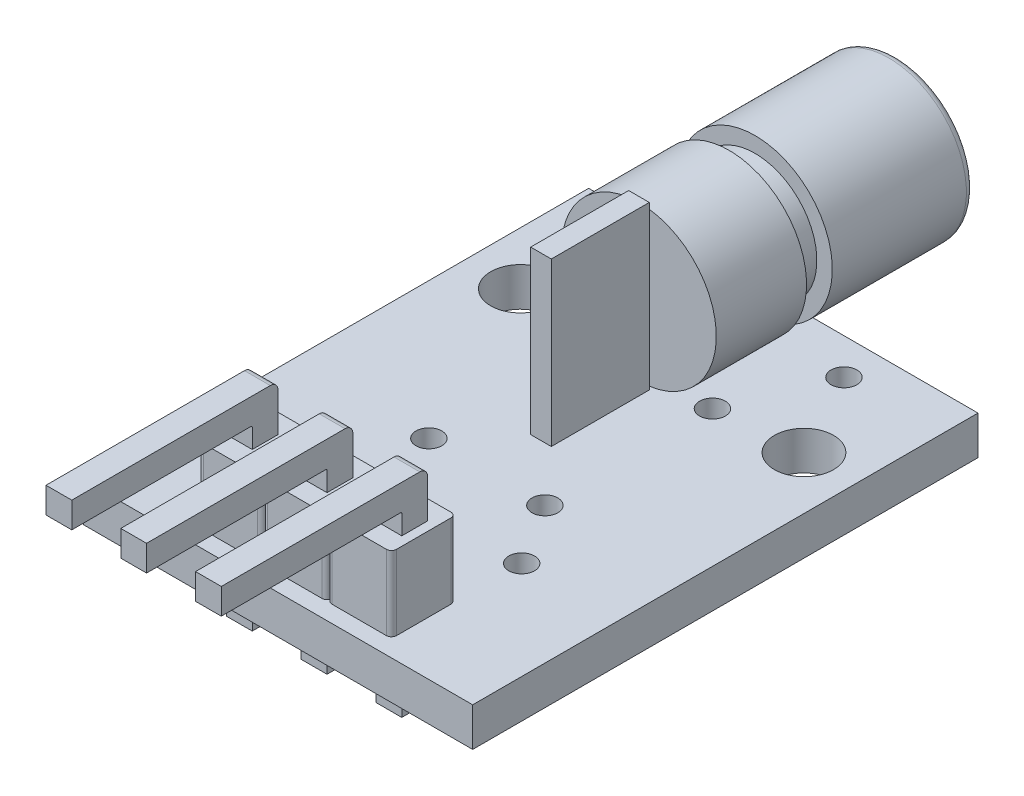
from build123d import *

# Parameters (mm, degrees)
SKETCH1_W           = 15.1
SKETCH1_H           = 19.6
BOSS_EXTRUDE1_DEPTH = 1.5
SKETCH2_W           = 1
SKETCH2_H           = 1
BOSS_EXTRUDE2_DEPTH = 1.7
BOSS_EXTRUDE3_DEPTH = 2.9
SKETCH4_W           = 1
SKETCH4_H           = 1
BOSS_EXTRUDE4_DEPTH = 1.8
SKETCH5_W           = 1
SKETCH5_H           = 1
BOSS_EXTRUDE5_DEPTH = 7
SKETCH7_W           = 0.8
SKETCH7_H           = 3.8
BOSS_EXTRUDE6_DEPTH = 6.3
SKETCH8_R           = 3
BOSS_EXTRUDE7_DEPTH = 3.5
SKETCH9_R           = 2.4
BOSS_EXTRUDE8_DEPTH = 1
SKETCH10_R          = 3
BOSS_EXTRUDE9_DEPTH = 5.5
FILLET1_R           = 0.3
SKETCH11_R          = 1.5
CUT_EXTRUDE1_DEPTH  = 1
SKETCH12_R          = 1.15
CUT_EXTRUDE2_DEPTH  = 19.271631016
CUT_EXTRUDE3_REACH  = 20.842
SKETCH13_R          = 0.5
CUT_EXTRUDE4_REACH  = 20.842
SKETCH14_R          = 0.5
FILLET2_R           = 0.2
FILLET3_R           = 0.05
FILLET5_R           = 0.3


with BuildPart() as part:
    # Sketch1 → Boss-Extrude1 (new body)
    with BuildSketch(Plane(origin=(0, 0, 0), x_dir=(1, 0, 0), z_dir=(0, 1, 0))):
        Rectangle(SKETCH1_W, SKETCH1_H)
    extrude(amount=BOSS_EXTRUDE1_DEPTH)

    # Sketch2 → Boss-Extrude2 (add)
    with BuildSketch(Plane.XZ):
        with Locations((0, 7.9)):
            Rectangle(SKETCH2_W, SKETCH2_H)
        with Locations((2.9, 7.9)):
            Rectangle(SKETCH2_W, SKETCH2_H)
        with Locations((-2.9, 7.9)):
            Rectangle(SKETCH2_W, SKETCH2_H)
    extrude(amount=BOSS_EXTRUDE2_DEPTH)

    # Sketch3 → Boss-Extrude3 (add)
    with BuildSketch(Plane(origin=(0, 1.5, 0), x_dir=(1, 0, 0), z_dir=(0, 1, 0))):
        with BuildLine():
            Line((-3.75, -9.15), (-3.75, -6.65))
            Line((-3.75, -6.65), (-1.45, -6.65))
            ThreePointArc((-1.45, -6.65), (-1.308578644, -6.708578644), (-1.25, -6.85))
            ThreePointArc((-1.25, -6.85), (-1.191421356, -6.708578644), (-1.05, -6.65))
            Line((-1.05, -6.65), (1.05, -6.65))
            ThreePointArc((1.05, -6.65), (1.191421356, -6.708578644), (1.25, -6.85))
            ThreePointArc((1.25, -6.85), (1.308578644, -6.708578644), (1.45, -6.65))
            Line((1.45, -6.65), (3.75, -6.65))
            Line((3.75, -6.65), (3.75, -9.15))
            Line((3.75, -9.15), (1.45, -9.15))
            ThreePointArc((1.45, -9.15), (1.308578644, -9.091421356), (1.25, -8.95))
            ThreePointArc((1.25, -8.95), (1.191421356, -9.091421356), (1.05, -9.15))
            Line((1.05, -9.15), (-1.05, -9.15))
            ThreePointArc((-1.05, -9.15), (-1.191421356, -9.091421356), (-1.25, -8.95))
            ThreePointArc((-1.25, -8.95), (-1.308578644, -9.091421356), (-1.45, -9.15))
            Line((-1.45, -9.15), (-3.75, -9.15))
        make_face()
    extrude(amount=BOSS_EXTRUDE3_DEPTH)

    # Sketch4 → Boss-Extrude4 (add)
    with BuildSketch(Plane(origin=(0, 4.4, 0), x_dir=(1, 0, 0), z_dir=(0, 1, 0))):
        with Locations((-2.9, -7.9)):
            Rectangle(SKETCH4_W, SKETCH4_H)
        with Locations((0, -7.9)):
            Rectangle(SKETCH4_W, SKETCH4_H)
        with Locations((2.9, -7.9)):
            Rectangle(SKETCH4_W, SKETCH4_H)
    extrude(amount=BOSS_EXTRUDE4_DEPTH)

    # Sketch5 → Boss-Extrude5 (add)
    with BuildSketch(Plane.XY.offset(8.4)):
        with Locations((-2.9, 5.7)):
            Rectangle(SKETCH5_W, SKETCH5_H)
        with Locations((0, 5.7)):
            Rectangle(SKETCH5_W, SKETCH5_H)
        with Locations((2.9, 5.7)):
            Rectangle(SKETCH5_W, SKETCH5_H)
    extrude(amount=BOSS_EXTRUDE5_DEPTH)

    # Sketch7 → Boss-Extrude6 (add)
    with BuildSketch(Plane(origin=(0, 1.5, 0), x_dir=(1, 0, 0), z_dir=(0, 1, 0))):
        with Locations((0, 2.3)):
            Rectangle(SKETCH7_W, SKETCH7_H)
    extrude(amount=BOSS_EXTRUDE6_DEPTH)

    # Sketch8 → Boss-Extrude7 (add)
    with BuildSketch(Plane(origin=(0, 0, -4.2), x_dir=(-1, 0, 0), z_dir=(0, 0, -1))):
        with Locations(Location((0, 4.6, 0), (0, 0, 262.337744339))):
            Circle(SKETCH8_R)
    extrude(amount=BOSS_EXTRUDE7_DEPTH)

    # Sketch9 → Boss-Extrude8 (add)
    with BuildSketch(Plane(origin=(0, 0, -7.7), x_dir=(-1, 0, 0), z_dir=(0, 0, -1))):
        with Locations((0, 4.6)):
            Circle(SKETCH9_R)
    extrude(amount=BOSS_EXTRUDE8_DEPTH)

    # Sketch10 → Boss-Extrude9 (add)
    with BuildSketch(Plane(origin=(0, 0, -8.7), x_dir=(-1, 0, 0), z_dir=(0, 0, -1))):
        with Locations(Location((0, 4.6, 0), (0, 0, 262.337744339))):
            Circle(SKETCH10_R)
    extrude(amount=BOSS_EXTRUDE9_DEPTH)

    # Fillet1
    fillet1_edges = [part.edges().sort_by_distance(p)[0] for p in [
        (-0.4, 7.573213749, -14.2),
    ]]
    fillet(fillet1_edges, radius=FILLET1_R)

    # Sketch11 → Cut-Extrude1 (cut)
    with BuildSketch(Plane(origin=(0, 0, -14.2), x_dir=(-1, 0, 0), z_dir=(0, 0, -1))):
        with Locations((0, 4.6)):
            Circle(SKETCH11_R)
    extrude(amount=-CUT_EXTRUDE1_DEPTH, mode=Mode.SUBTRACT)

    # Sketch12 → Cut-Extrude2 (cut, through all)
    with BuildSketch(Plane(origin=(0, 1.5, 0), x_dir=(1, 0, 0), z_dir=(0, 1, 0))):
        with Locations(Location((-5.5, 5.1, 0), (0, 0, 270))):
            Circle(SKETCH12_R)
        with Locations(Location((5.5, 5.1, 0), (0, 0, 270))):
            Circle(SKETCH12_R)
    extrude(amount=-CUT_EXTRUDE2_DEPTH, mode=Mode.SUBTRACT)

    # Sketch13 → Cut-Extrude3 (cut, up to next)
    with BuildSketch(Plane.XZ, mode=Mode.PRIVATE) as cut_extrude3_sk1:
        with Locations(Location((-2.25, -4.8, 0), (0, 0, 270))):
            Circle(SKETCH13_R)
    cut_extrude3_tool1 = extrude(cut_extrude3_sk1.sketch, amount=-CUT_EXTRUDE3_REACH, mode=Mode.PRIVATE) & part.part
    # Sketch13 → Cut-Extrude3 (cut, up to next)
    with BuildSketch(Plane.XZ, mode=Mode.PRIVATE) as cut_extrude3_sk2:
        with Locations(Location((2.25, -4.8, 0), (0, 0, 270))):
            Circle(SKETCH13_R)
    cut_extrude3_tool2 = extrude(cut_extrude3_sk2.sketch, amount=-CUT_EXTRUDE3_REACH, mode=Mode.PRIVATE) & part.part
    # Sketch13 → Cut-Extrude3 (cut, up to next)
    with BuildSketch(Plane.XZ, mode=Mode.PRIVATE) as cut_extrude3_sk3:
        with Locations(Location((2.25, 1.7, 0), (0, 0, 270))):
            Circle(SKETCH13_R)
    cut_extrude3_tool3 = extrude(cut_extrude3_sk3.sketch, amount=-CUT_EXTRUDE3_REACH, mode=Mode.PRIVATE) & part.part
    # Sketch13 → Cut-Extrude3 (cut, up to next)
    with BuildSketch(Plane.XZ, mode=Mode.PRIVATE) as cut_extrude3_sk4:
        with Locations(Location((-2.25, 1.7, 0), (0, 0, 270))):
            Circle(SKETCH13_R)
    cut_extrude3_tool4 = extrude(cut_extrude3_sk4.sketch, amount=-CUT_EXTRUDE3_REACH, mode=Mode.PRIVATE) & part.part
    add(cut_extrude3_tool1.solids().sort_by_distance((-2.25, 0, -4.8))[0], mode=Mode.SUBTRACT)
    add(cut_extrude3_tool2.solids().sort_by_distance((2.25, 0, -4.8))[0], mode=Mode.SUBTRACT)
    add(cut_extrude3_tool3.solids().sort_by_distance((2.25, 0, 1.7))[0], mode=Mode.SUBTRACT)
    add(cut_extrude3_tool4.solids().sort_by_distance((-2.25, 0, 1.7))[0], mode=Mode.SUBTRACT)

    # Sketch14 → Cut-Extrude4 (cut, up to next)
    with BuildSketch(Plane.XZ, mode=Mode.PRIVATE) as cut_extrude4_sk1:
        with Locations(Location((3.75, 4.1, 0), (0, 0, 270))):
            Circle(SKETCH14_R)
    cut_extrude4_tool1 = extrude(cut_extrude4_sk1.sketch, amount=-CUT_EXTRUDE4_REACH, mode=Mode.PRIVATE) & part.part
    # Sketch14 → Cut-Extrude4 (cut, up to next)
    with BuildSketch(Plane.XZ, mode=Mode.PRIVATE) as cut_extrude4_sk2:
        with Locations(Location((-3.75, 4.1, 0), (0, 0, 270))):
            Circle(SKETCH14_R)
    cut_extrude4_tool2 = extrude(cut_extrude4_sk2.sketch, amount=-CUT_EXTRUDE4_REACH, mode=Mode.PRIVATE) & part.part
    # Sketch14 → Cut-Extrude4 (cut, up to next)
    with BuildSketch(Plane.XZ, mode=Mode.PRIVATE) as cut_extrude4_sk3:
        with Locations(Location((-3.75, -8.4, 0), (0, 0, 270))):
            Circle(SKETCH14_R)
    cut_extrude4_tool3 = extrude(cut_extrude4_sk3.sketch, amount=-CUT_EXTRUDE4_REACH, mode=Mode.PRIVATE) & part.part
    # Sketch14 → Cut-Extrude4 (cut, up to next)
    with BuildSketch(Plane.XZ, mode=Mode.PRIVATE) as cut_extrude4_sk4:
        with Locations(Location((3.75, -8.4, 0), (0, 0, 270))):
            Circle(SKETCH14_R)
    cut_extrude4_tool4 = extrude(cut_extrude4_sk4.sketch, amount=-CUT_EXTRUDE4_REACH, mode=Mode.PRIVATE) & part.part
    add(cut_extrude4_tool1.solids().sort_by_distance((3.75, 0, 4.1))[0], mode=Mode.SUBTRACT)
    add(cut_extrude4_tool2.solids().sort_by_distance((-3.75, 0, 4.1))[0], mode=Mode.SUBTRACT)
    add(cut_extrude4_tool3.solids().sort_by_distance((-3.75, 0, -8.4))[0], mode=Mode.SUBTRACT)
    add(cut_extrude4_tool4.solids().sort_by_distance((3.75, 0, -8.4))[0], mode=Mode.SUBTRACT)

    # Fillet2
    fillet2_edges = [part.edges().sort_by_distance(p)[0] for p in [
        (-3.75, 2.95, 9.15),
        (3.75, 2.95, 9.15),
        (3.75, 2.95, 6.65),
        (-3.75, 2.95, 6.65),
    ]]
    fillet(fillet2_edges, radius=FILLET2_R)

    # Fillet3
    fillet3_edges = [part.edges().sort_by_distance(p)[0] for p in [
        (-2.9, 5.2, 8.4),
        (0, 5.2, 8.4),
        (2.9, 5.2, 8.4),
    ]]
    fillet(fillet3_edges, radius=FILLET3_R)

    # Fillet5
    fillet5_edges = [part.edges().sort_by_distance(p)[0] for p in [
        (-2.9, 6.2, 7.4),
        (0, 6.2, 7.4),
        (2.9, 6.2, 7.4),
    ]]
    fillet(fillet5_edges, radius=FILLET5_R)


solid = part.part
